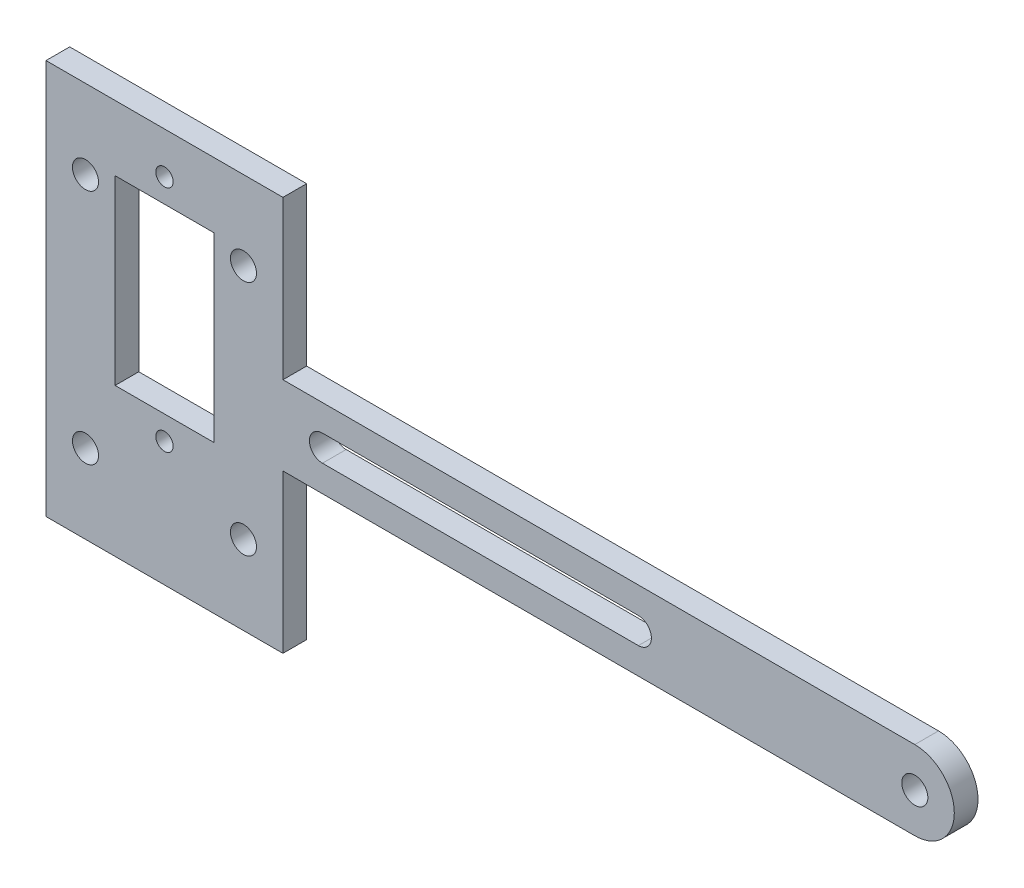
from build123d import *

# Parameters (mm, degrees)
SKETCH_1_R      = 1.1
SKETCH_1_R_2    = 1.65
SKETCH_1_W      = 12.5
SKETCH_1_H      = 23
EXTRUDE_1_DEPTH = 3


with BuildPart() as part:
    # 草图1 → 凸台-拉伸1 (new body)
    with BuildSketch(Plane.XY):
        with BuildLine():
            Line((15, -25), (15, -5))
            Line((15, -5), (95, -5))
            ThreePointArc((95, -5), (100, 0), (95, 5))
            Line((95, 5), (15, 5))
            Line((15, 5), (15, 25))
            Line((15, 25), (-15, 25))
            Line((-15, 25), (-15, -25))
            Line((-15, -25), (15, -25))
        make_face()
        with Locations((0, 19.75)):
            Circle(SKETCH_1_R, mode=Mode.SUBTRACT)
        with Locations((0, -9.25)):
            Circle(SKETCH_1_R, mode=Mode.SUBTRACT)
        with Locations((95, 0)):
            Circle(SKETCH_1_R_2, mode=Mode.SUBTRACT)
        with Locations((10, 15)):
            Circle(SKETCH_1_R_2, mode=Mode.SUBTRACT)
        with Locations((-10, 15)):
            Circle(SKETCH_1_R_2, mode=Mode.SUBTRACT)
        with Locations(Location((10, -15, 0), (0, 0, 180))):
            Circle(SKETCH_1_R_2, mode=Mode.SUBTRACT)
        with Locations(Location((-10, -15, 0), (0, 0, 180))):
            Circle(SKETCH_1_R_2, mode=Mode.SUBTRACT)
        with Locations((0, 5.25)):
            Rectangle(SKETCH_1_W, SKETCH_1_H, mode=Mode.SUBTRACT)
        with BuildLine():
            Line((20, -1.65), (60, -1.65))
            ThreePointArc((60, -1.65), (61.65, 0), (60, 1.65))
            Line((60, 1.65), (20, 1.65))
            ThreePointArc((20, 1.65), (18.35, 0), (20, -1.65))
        make_face(mode=Mode.SUBTRACT)
    extrude(amount=EXTRUDE_1_DEPTH)


solid = part.part
